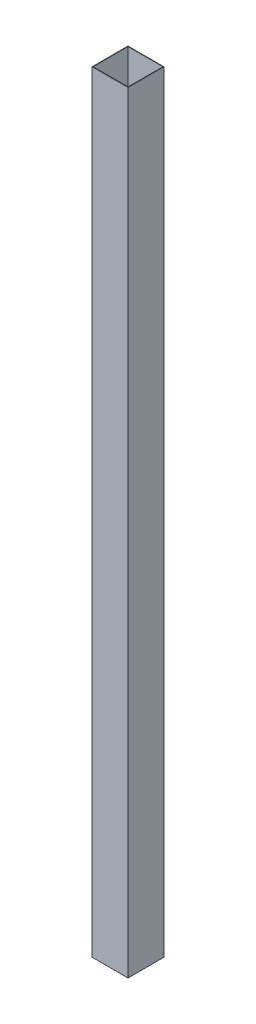
from build123d import *

# Parameters (mm, degrees)
SKETCH1_W           = 40
SKETCH1_H           = 40
BOSS_EXTRUDE2_DEPTH = 860
SKETCH2_W           = 39
SKETCH2_H           = 39
CUT_EXTRUDE1_DEPTH  = 861.464990572


with BuildPart() as part:
    # Sketch1 → Boss-Extrude2 (new body)
    with BuildSketch(Plane(origin=(0, 0, 0), x_dir=(1, 0, 0), z_dir=(0, 1, 0))):
        Rectangle(SKETCH1_W, SKETCH1_H)
    extrude(amount=BOSS_EXTRUDE2_DEPTH)

    # Sketch2 → Cut-Extrude1 (cut, through all)
    with BuildSketch(Plane.XZ):
        Rectangle(SKETCH2_W, SKETCH2_H)
    extrude(amount=-CUT_EXTRUDE1_DEPTH, mode=Mode.SUBTRACT)


solid = part.part
